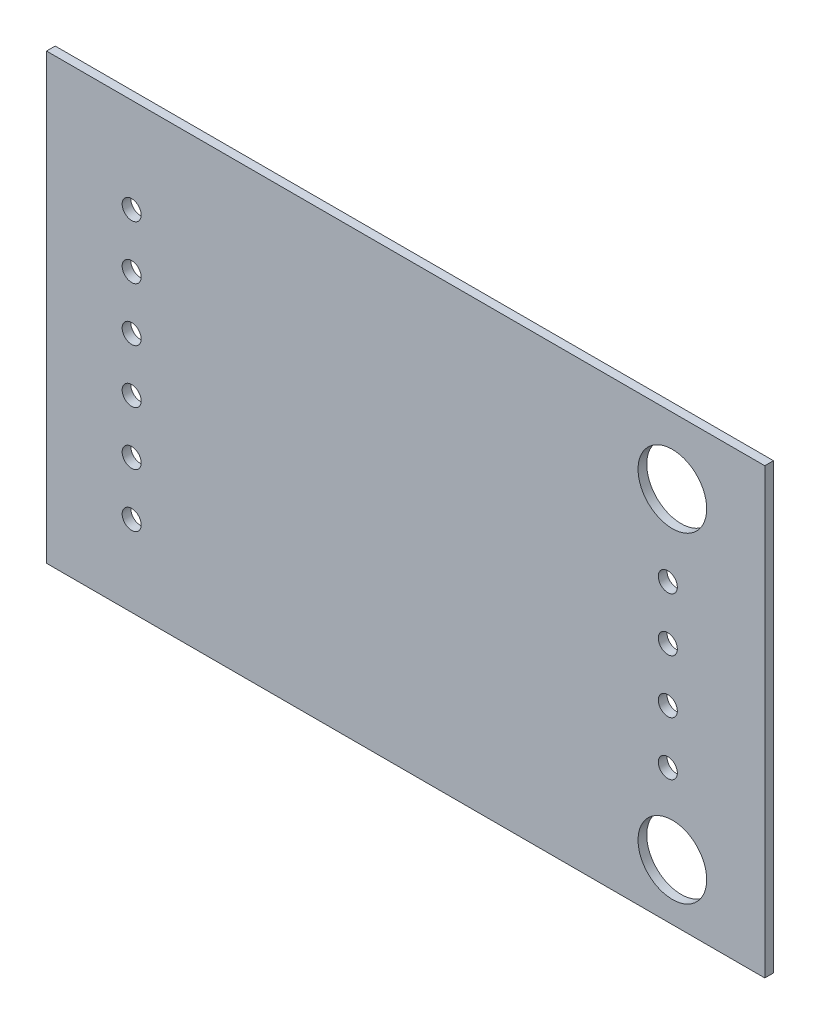
from build123d import *

# Parameters (mm, degrees)
ESBO_O1_W                = 34.00000312
ESBO_O1_H                = 21.00000372
ESBO_O1_R                = 0.4499991
RESSALTO_EXTRUS_O1_DEPTH = 0.41148
ESBO_O2_R                = 1.625
CORTE_EXTRUS_O1_DEPTH    = 40.964622871


with BuildPart() as part:
    # Esboço1 → Ressalto-extrusão1 (new body)
    with BuildSketch(Plane.XY.offset(0.41148)):
        with Locations((17.00001426, 10.50001456)):
            Rectangle(ESBO_O1_W, ESBO_O1_H)
        with Locations(Location((29.409885994, 11.411813558, 0), (0, 0, 180))):
            Circle(ESBO_O1_R, mode=Mode.SUBTRACT)
        with Locations(Location((29.409885994, 8.871813558, 0), (0, 0, 180))):
            Circle(ESBO_O1_R, mode=Mode.SUBTRACT)
        with Locations(Location((29.409885994, 13.951813558, 0), (0, 0, 180))):
            Circle(ESBO_O1_R, mode=Mode.SUBTRACT)
        with Locations(Location((29.409885994, 6.331813558, 0), (0, 0, 180))):
            Circle(ESBO_O1_R, mode=Mode.SUBTRACT)
        with Locations(Location((4.030717622, 3.815479677, 0), (0, 0, 180))):
            Circle(ESBO_O1_R, mode=Mode.SUBTRACT)
        with Locations(Location((4.030717622, 13.975479677, 0), (0, 0, 180))):
            Circle(ESBO_O1_R, mode=Mode.SUBTRACT)
        with Locations(Location((4.030717622, 11.435479677, 0), (0, 0, 180))):
            Circle(ESBO_O1_R, mode=Mode.SUBTRACT)
        with Locations(Location((4.030717622, 16.515479677, 0), (0, 0, 180))):
            Circle(ESBO_O1_R, mode=Mode.SUBTRACT)
        with Locations(Location((4.030717622, 6.355479677, 0), (0, 0, 180))):
            Circle(ESBO_O1_R, mode=Mode.SUBTRACT)
        with Locations(Location((4.030717622, 8.895479677, 0), (0, 0, 180))):
            Circle(ESBO_O1_R, mode=Mode.SUBTRACT)
    extrude(amount=-RESSALTO_EXTRUS_O1_DEPTH)

    # Esboço2 → Corte-extrusão1 (cut, through all)
    with BuildSketch(Plane.XY.offset(0.41148)):
        with Locations((29.625048643, 17.858037309)):
            Circle(ESBO_O2_R)
        with Locations((29.625048643, 2.658236219)):
            Circle(ESBO_O2_R)
    extrude(amount=-CORTE_EXTRUS_O1_DEPTH, mode=Mode.SUBTRACT)


solid = part.part
